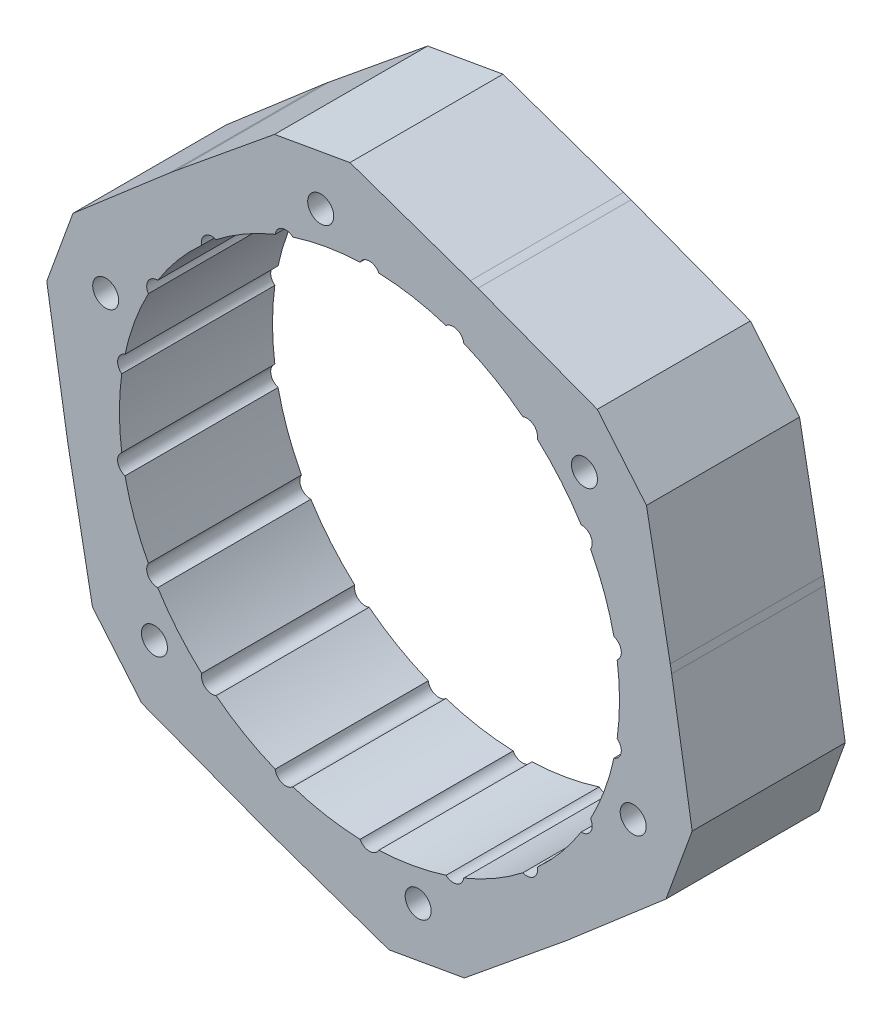
from build123d import *

# Parameters (mm, degrees)
SKETCH1_R           = 60
BOSS_EXTRUDE1_DEPTH = 30
SKETCH2_R           = 2.55
CUT_EXTRUDE2_DEPTH  = 91
BOSS_EXTRUDE2_START = -30
BOSS_EXTRUDE2_DEPTH = 30


with BuildPart() as part:
    # Sketch1 → Boss-Extrude1 (new body)
    with BuildSketch(Plane.XY):
        Circle(SKETCH1_R)
        with BuildLine():
            ThreePointArc((-15.015830627, 46.642521701), (-17.128368778, 47.059806449), (-18.478441423, 45.382234438))
            ThreePointArc((-18.478441423, 45.382234438), (-24.5, 42.435244785), (-30.062947192, 38.693916914))
            ThreePointArc((-30.062947192, 38.693916914), (-32.190803493, 38.363505711), (-32.885693376, 36.325351632))
            ThreePointArc((-32.885693376, 36.325351632), (-37.536177713, 31.496592875), (-41.484028644, 26.078254686))
            ThreePointArc((-41.484028644, 26.078254686), (-43.370552222, 25.04), (-43.326445366, 22.887095314))
            ThreePointArc((-43.326445366, 22.887095314), (-46.044938419, 16.758987023), (-47.901524003, 10.317170068))
            ThreePointArc((-47.901524003, 10.317170068), (-49.319172271, 8.696300738), (-48.541388615, 6.688317524))
            ThreePointArc((-48.541388615, 6.688317524), (-49, 0), (-48.541388615, -6.688317524))
            ThreePointArc((-48.541388615, -6.688317524), (-49.319172271, -8.696300738), (-47.901524003, -10.317170068))
            ThreePointArc((-47.901524003, -10.317170068), (-46.044938419, -16.758987023), (-43.326445366, -22.887095314))
            ThreePointArc((-43.326445366, -22.887095314), (-43.370552222, -25.04), (-41.484028644, -26.078254686))
            ThreePointArc((-41.484028644, -26.078254686), (-37.536177713, -31.496592875), (-32.885693376, -36.325351632))
            ThreePointArc((-32.885693376, -36.325351632), (-32.190803493, -38.363505711), (-30.062947192, -38.693916914))
            ThreePointArc((-30.062947192, -38.693916914), (-24.5, -42.435244785), (-18.478441423, -45.382234438))
            ThreePointArc((-18.478441423, -45.382234438), (-17.128368778, -47.059806449), (-15.015830627, -46.642521701))
            ThreePointArc((-15.015830627, -46.642521701), (-8.508760706, -48.255579898), (-1.842416722, -48.96535))
            ThreePointArc((-1.842416722, -48.96535), (0, -50.08), (1.842416722, -48.96535))
            ThreePointArc((1.842416722, -48.96535), (8.508760706, -48.255579898), (15.015830627, -46.642521701))
            ThreePointArc((15.015830627, -46.642521701), (17.128368778, -47.059806449), (18.478441423, -45.382234438))
            ThreePointArc((18.478441423, -45.382234438), (24.5, -42.435244785), (30.062947192, -38.693916914))
            ThreePointArc((30.062947192, -38.693916914), (32.190803493, -38.363505711), (32.885693376, -36.325351632))
            ThreePointArc((32.885693376, -36.325351632), (37.536177713, -31.496592875), (41.484028644, -26.078254686))
            ThreePointArc((41.484028644, -26.078254686), (43.370552222, -25.04), (43.326445366, -22.887095314))
            ThreePointArc((43.326445366, -22.887095314), (46.044938419, -16.758987023), (47.901524003, -10.317170068))
            ThreePointArc((47.901524003, -10.317170068), (49.319172271, -8.696300738), (48.541388615, -6.688317524))
            ThreePointArc((48.541388615, -6.688317524), (49, 0), (48.541388615, 6.688317524))
            ThreePointArc((48.541388615, 6.688317524), (49.319172271, 8.696300738), (47.901524003, 10.317170068))
            ThreePointArc((47.901524003, 10.317170068), (46.044938419, 16.758987023), (43.326445366, 22.887095314))
            ThreePointArc((43.326445366, 22.887095314), (43.370552222, 25.04), (41.484028644, 26.078254686))
            ThreePointArc((41.484028644, 26.078254686), (37.536177713, 31.496592875), (32.885693376, 36.325351632))
            ThreePointArc((32.885693376, 36.325351632), (32.190803493, 38.363505711), (30.062947192, 38.693916914))
            ThreePointArc((30.062947192, 38.693916914), (24.5, 42.435244785), (18.478441423, 45.382234438))
            ThreePointArc((18.478441423, 45.382234438), (17.128368778, 47.059806449), (15.015830627, 46.642521701))
            ThreePointArc((15.015830627, 46.642521701), (8.508760706, 48.255579898), (1.842416722, 48.96535))
            ThreePointArc((1.842416722, 48.96535), (0, 50.08), (-1.842416722, 48.96535))
            ThreePointArc((-1.842416722, 48.96535), (-8.508760706, 48.255579898), (-15.015830627, 46.642521701))
        make_face(mode=Mode.SUBTRACT)
    extrude(amount=BOSS_EXTRUDE1_DEPTH)

    # Sketch2 → Cut-Extrude2 (cut, through all)
    with BuildSketch(Plane.XY.offset(30)):
        with Locations((-9.550649772, 54.164426416)):
            Circle(SKETCH2_R)
        with Locations((42.132444372, 35.353318533)):
            Circle(SKETCH2_R)
        with Locations((51.683094143, -18.811107883)):
            Circle(SKETCH2_R)
        with Locations((9.550649772, -54.164426416)):
            Circle(SKETCH2_R)
        with Locations((-42.132444372, -35.353318533)):
            Circle(SKETCH2_R)
        with Locations((-51.683094143, 18.811107883)):
            Circle(SKETCH2_R)
    extrude(amount=-CUT_EXTRUDE2_DEPTH, mode=Mode.SUBTRACT)

    # Sketch3 → Boss-Extrude2 (add)
    with BuildSketch(Plane.XY.offset(30).offset(BOSS_EXTRUDE2_START)):
        with BuildLine():
            Line((-37.958811886, 46.46642444), (-18.597801703, 62.282596059))
            Line((-18.597801703, 62.282596059), (-3.825685408, 64.887318724))
            Line((-3.825685408, 64.887318724), (19.777162276, 56.646834442))
            ThreePointArc((19.777162276, 56.646834442), (-10.41889066, 59.088465181), (-37.958811886, 46.46642444))
        make_face()
        with BuildLine():
            Line((54.281223694, 35.756800112), (58.946178809, 11.195892275))
            ThreePointArc((58.946178809, 11.195892275), (45.962666587, 38.567256581), (21.261698045, 56.106507611))
            Line((21.261698045, 56.106507611), (44.639409549, 47.247466759))
            Line((44.639409549, 47.247466759), (54.281223694, 35.756800112))
        make_face()
        with BuildLine():
            Line((58.106909102, -29.130518612), (39.169016532, -45.450942167))
            ThreePointArc((39.169016532, -45.450942167), (56.381557247, -20.5212086), (59.220509931, 9.640083171))
            Line((59.220509931, 9.640083171), (63.237211252, -15.0351293))
            Line((63.237211252, -15.0351293), (58.106909102, -29.130518612))
        make_face()
        with BuildLine():
            Line((3.825685408, -64.887318724), (-19.777162276, -56.646834442))
            ThreePointArc((-19.777162276, -56.646834442), (10.41889066, -59.088465181), (37.958811886, -46.46642444))
            Line((37.958811886, -46.46642444), (18.597801703, -62.282596059))
            Line((18.597801703, -62.282596059), (3.825685408, -64.887318724))
        make_face()
        with BuildLine():
            Line((-54.281223694, -35.756800112), (-58.946178809, -11.195892275))
            ThreePointArc((-58.946178809, -11.195892275), (-45.962666587, -38.567256581), (-21.261698045, -56.106507611))
            Line((-21.261698045, -56.106507611), (-44.639409549, -47.247466759))
            Line((-44.639409549, -47.247466759), (-54.281223694, -35.756800112))
        make_face()
        with BuildLine():
            Line((-58.106909102, 29.130518612), (-39.169016532, 45.450942167))
            ThreePointArc((-39.169016532, 45.450942167), (-56.381557247, 20.5212086), (-59.220509931, -9.640083171))
            Line((-59.220509931, -9.640083171), (-63.237211252, 15.0351293))
            Line((-63.237211252, 15.0351293), (-58.106909102, 29.130518612))
        make_face()
    extrude(amount=BOSS_EXTRUDE2_DEPTH)


solid = part.part
